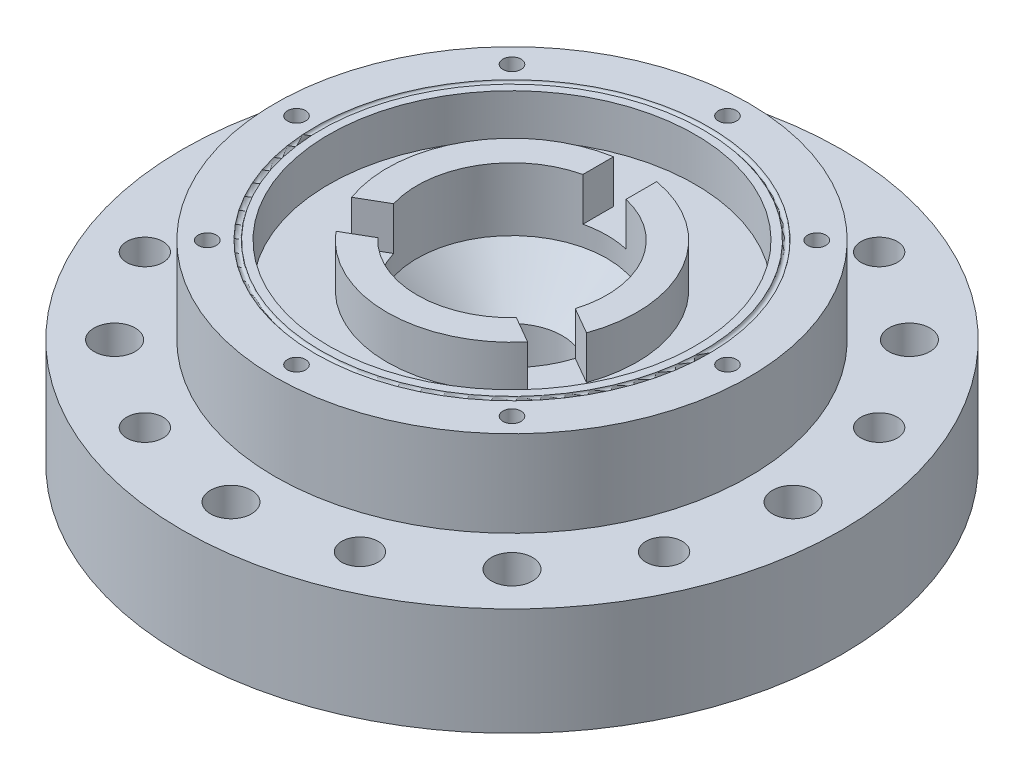
from build123d import *

# Parameters (mm, degrees)
SKETCH4_R            = 4.7625
CUT_EXTRUDE2_DEPTH   = 114.707959264
CIRPATTERN1_COUNT    = 8
SKETCH6_R            = 42.5
SKETCH6_R_2          = 29
CUT_EXTRUDE3_DEPTH   = 10
SKETCH7_W            = 10
SKETCH7_H            = 7.550043706
CUT_EXTRUDE4_DEPTH   = 10
CIRPATTERN2_COUNT    = 3
CIRPATTERN4_COUNT    = 8
CIRPATTERN5_COUNT    = 8
SKETCH25_R           = 56.85
SKETCH25_R_2         = 53.85
BOSS_EXTRUDE1_DEPTH  = 6
FILLET1_R            = 10
CUT_SWEEP1_PROFILE_R = 0.625
CUT_SWEEP2_PROFILE_R = 0.625


with BuildPart() as part:
    # Sketch3 → Revolve1 (revolve)
    with BuildSketch(Plane(origin=(0, 0, 0), x_dir=(0, 0, -1), z_dir=(1, 0, 0))):
        with BuildLine():
            Line((76.5, 15), (55, 15))
            Line((55, 15), (55, 35))
            Line((55, 35), (22.025, 35))
            Line((22.025, 35), (22.025, 20.36))
            Line((22.025, 20.36), (11.665, 10))
            Line((11.665, 10), (11.665, 0))
            Line((11.665, 0), (16.665, 0))
            ThreePointArc((16.665, 0), (37.471852779, 3.234070807), (53.85, -10))
            Line((53.85, -10), (76.5, -10))
            Line((76.5, -10), (76.5, 15))
        make_face()
    revolve(axis=Axis((0, 0, 0), (0, 1, 0)))

    # Sketch4 → Cut-Extrude2 (cut, symmetric)
    with BuildSketch(Plane(origin=(0, 0, 0), x_dir=(1, 0, 0), z_dir=(0, 1, 0))):
        with Locations(Location((-65.2, 0, 0), (0, 0, 270))):
            Circle(SKETCH4_R)
    cut_extrude2 = extrude(amount=CUT_EXTRUDE2_DEPTH, both=True, mode=Mode.SUBTRACT)

    # CirPattern1: Cut-Extrude2 ×8 about axis
    cirpattern1_axis = Axis((0, 0, 0), (0, 1, 0))
    for i in range(1, CIRPATTERN1_COUNT):
        add(cut_extrude2.rotate(cirpattern1_axis, i * 360 / CIRPATTERN1_COUNT), mode=Mode.SUBTRACT)

    # Sketch6 → Cut-Extrude3 (cut)
    with BuildSketch(Plane(origin=(0, 35, 0), x_dir=(1, 0, 0), z_dir=(0, 1, 0))):
        with Locations(Location((0, 0, 0), (0, 0, 270))):
            Circle(SKETCH6_R)
        with Locations(Location((0, 0, 0), (0, 0, 270))):
            Circle(SKETCH6_R_2, mode=Mode.SUBTRACT)
    extrude(amount=-CUT_EXTRUDE3_DEPTH, mode=Mode.SUBTRACT)

    # Sketch7 → Cut-Extrude4 (cut)
    with BuildSketch(Plane(origin=(0, 35, 0), x_dir=(1, 0, 0), z_dir=(0, 1, 0))):
        with Locations((0, 25.224978147)):
            Rectangle(SKETCH7_W, SKETCH7_H)
    cut_extrude4 = extrude(amount=-CUT_EXTRUDE4_DEPTH, mode=Mode.SUBTRACT)

    # CirPattern2: Cut-Extrude4 ×3 about axis
    cirpattern2_axis = Axis((0, 0, 0), (0, 1, 0))
    for i in range(1, CIRPATTERN2_COUNT):
        add(cut_extrude4.rotate(cirpattern2_axis, i * 360 / CIRPATTERN2_COUNT), mode=Mode.SUBTRACT)

    # Sketch15 → Tap Drill for 3/8-24 Tap1 (revolve, cut)
    with BuildSketch(Plane(origin=(-60.23694552, 15, -24.95095979), x_dir=(0, 0, 1), z_dir=(1, 0, 0))):
        Polygon((0, 0), (0, 27.533468714), (4.2164, 25), (4.2164, 0), align=None)
    tap_drill_for_3_8_24_tap1 = revolve(axis=Axis((-60.23694552, 21.35, -24.95095979), (0, -1, 0)), mode=Mode.SUBTRACT)

    # CirPattern4: Tap Drill for 3/8-24 Tap1 ×8 about axis
    cirpattern4_axis = Axis((0, 0, 0), (0, 1, 0))
    for i in range(1, CIRPATTERN4_COUNT):
        add(tap_drill_for_3_8_24_tap1.rotate(cirpattern4_axis, i * 360 / CIRPATTERN4_COUNT), mode=Mode.SUBTRACT)

    # Sketch20 → Tap Drill for M5x0.8 Tap1 (revolve, cut)
    with BuildSketch(Plane(origin=(-50, 35, 0), x_dir=(0, 0, 1), z_dir=(1, 0, 0))):
        Polygon((0, 0), (0, 21.2618073), (2.1, 20), (2.1, 0), align=None)
    tap_drill_for_m5x0_8_tap1 = revolve(axis=Axis((-50, 41.35, 0), (0, -1, 0)), mode=Mode.SUBTRACT)

    # CirPattern5: Tap Drill for M5x0.8 Tap1 ×8 about axis
    cirpattern5_axis = Axis((0, 0, 0), (0, 1, 0))
    for i in range(1, CIRPATTERN5_COUNT):
        add(tap_drill_for_m5x0_8_tap1.rotate(cirpattern5_axis, i * 360 / CIRPATTERN5_COUNT), mode=Mode.SUBTRACT)

    # Sketch25 → Boss-Extrude1 (add)
    with BuildSketch(Plane.XZ.offset(10)):
        with Locations(Location((0, 0, 0), (0, 0, 270))):
            Circle(SKETCH25_R)
        with Locations(Location((0, 0, 0), (0, 0, 270))):
            Circle(SKETCH25_R_2, mode=Mode.SUBTRACT)
    extrude(amount=BOSS_EXTRUDE1_DEPTH)

    # Fillet1
    fillet1_edges = [part.edges().sort_by_distance(p)[0] for p in [
        (0, -10, 53.85),
    ]]
    fillet(fillet1_edges, radius=FILLET1_R)

    # Cut-Sweep1: sweep along a path in Sketch26
    with BuildLine(Plane.XZ.offset(10)) as cut_sweep1_path:
        CenterArc((0, 0), 58, 0, 360)
    # Cut-Sweep1 profile (on start of the path) → Cut-Sweep1 (sweep, cut)
    with BuildSketch(Plane(origin=(58, -10, 0), x_dir=(1, 0, 0), z_dir=(0, 0, 1))):
        Circle(CUT_SWEEP1_PROFILE_R)
    sweep(path=cut_sweep1_path.line, mode=Mode.SUBTRACT)

    # Cut-Sweep2: sweep along a path in Sketch10
    with BuildLine(Plane(origin=(0, 35, 0), x_dir=(1, 0, 0), z_dir=(0, 1, 0))) as cut_sweep2_path:
        CenterArc((0, 0), 45, 0, 360)
    # Cut-Sweep2 profile (on start of the path) → Cut-Sweep2 (sweep, cut)
    with BuildSketch(Plane(origin=(45, 35, 0), x_dir=(-1, 0, 0), z_dir=(0, 0, -1))):
        Circle(CUT_SWEEP2_PROFILE_R)
    sweep(path=cut_sweep2_path.line, mode=Mode.SUBTRACT)


solid = part.part
